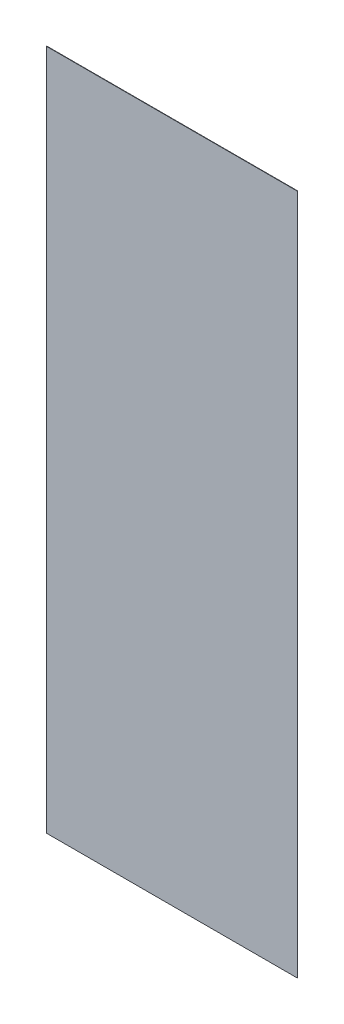
from build123d import *

# Parameters (mm, degrees)
OVEN_ARKA_KANAL_BOLME_SACI_1_START = -580
SKETCH1_W                          = 637
SKETCH1_H                          = 1730
OVEN_ARKA_KANAL_BOLME_SACI_1_DEPTH = 1


with BuildPart() as part:
    # Sketch1 → OVEN_arka_kanal_bolme_saci_1 (new body)
    with BuildSketch(Plane.XY.offset(OVEN_ARKA_KANAL_BOLME_SACI_1_START)):
        with Locations((350, 985)):
            Rectangle(SKETCH1_W, SKETCH1_H)
    extrude(amount=-OVEN_ARKA_KANAL_BOLME_SACI_1_DEPTH)


solid = part.part
